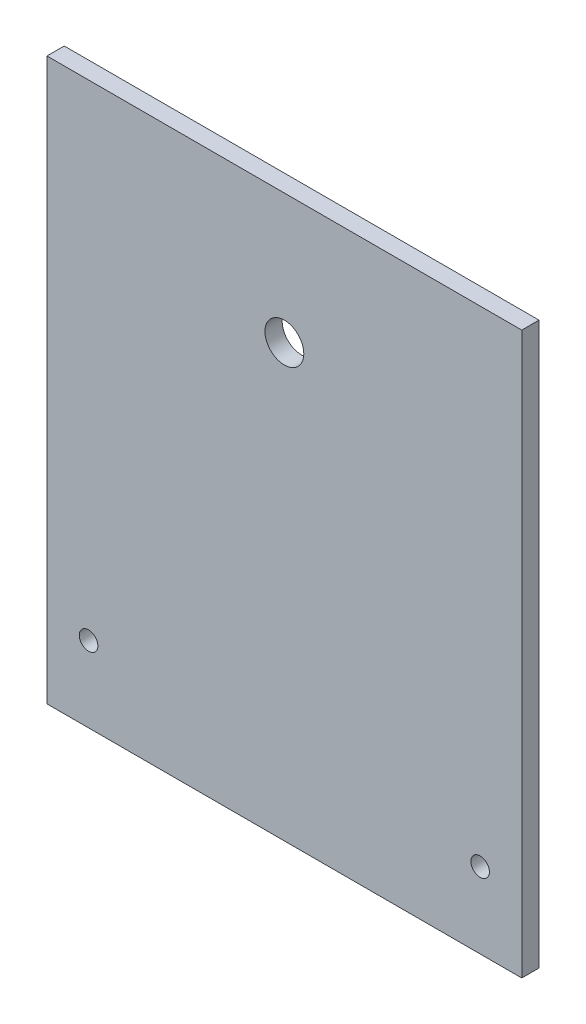
from build123d import *

# Parameters (mm, degrees)
SKETCH1_W           = 110
SKETCH1_H           = 130
BOSS_EXTRUDE1_DEPTH = 4
SKETCH2_R           = 4.5
CUT_EXTRUDE1_DEPTH  = 4
SKETCH4_R           = 2.15
CUT_EXTRUDE2_DEPTH  = 86.240835285
SKETCH5_R           = 2.15
CUT_EXTRUDE3_DEPTH  = 86.240835285


with BuildPart() as part:
    # Sketch1 → Boss-Extrude1 (new body)
    with BuildSketch(Plane.XY):
        Rectangle(SKETCH1_W, SKETCH1_H)
    extrude(amount=BOSS_EXTRUDE1_DEPTH)

    # Sketch2 → Cut-Extrude1 (cut)
    with BuildSketch(Plane.XY.offset(4)):
        with Locations((0, 34.993291231)):
            Circle(SKETCH2_R)
    extrude(amount=-CUT_EXTRUDE1_DEPTH, mode=Mode.SUBTRACT)

    # Sketch4 → Cut-Extrude2 (cut, through all)
    with BuildSketch(Plane.XY.offset(4)):
        with Locations((-45.36112854, -47.475954891)):
            Circle(SKETCH4_R)
    extrude(amount=-CUT_EXTRUDE2_DEPTH, mode=Mode.SUBTRACT)

    # Sketch5 → Cut-Extrude3 (cut, through all)
    with BuildSketch(Plane.XY.offset(4)):
        with Locations((45.36112854, -47.475954891)):
            Circle(SKETCH5_R)
    extrude(amount=-CUT_EXTRUDE3_DEPTH, mode=Mode.SUBTRACT)


solid = part.part
